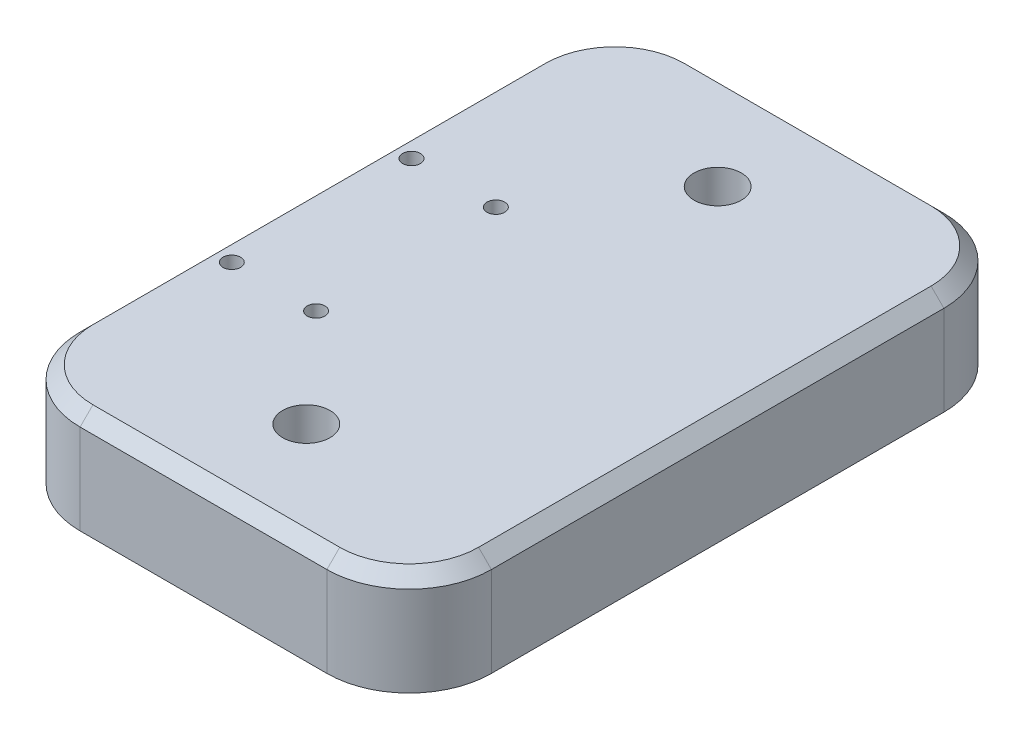
from build123d import *

# Parameters (mm, degrees)
SKETCH1_W           = 76.2
SKETCH1_H           = 12.7
BOSS_EXTRUDE1_DEPTH = 50.8
SKETCH3_R           = 1.0922
SKETCH3_R_2         = 2.921
CUT_EXTRUDE2_DEPTH  = 93.457395594
FILLET1_R           = 10.16
CHAMFER1_SIZE       = 1.5875


with BuildPart() as part:
    # Sketch1 → Boss-Extrude1 (new body)
    with BuildSketch(Plane(origin=(0, 0, 0), x_dir=(0, 0, -1), z_dir=(1, 0, 0))):
        with Locations((38.1, 6.35)):
            Rectangle(SKETCH1_W, SKETCH1_H)
    extrude(amount=BOSS_EXTRUDE1_DEPTH)

    # Sketch3 → Cut-Extrude2 (cut, through all)
    with BuildSketch(Plane.XZ):
        with Locations(Location((13.9065, -25.4, 0), (0, 0, 270))):
            Circle(SKETCH3_R)
        with Locations(Location((25.4, -63.5, 0), (0, 0, 270))):
            Circle(SKETCH3_R_2)
        with Locations(Location((25.4, -12.7, 0), (0, 0, 270))):
            Circle(SKETCH3_R_2)
        with Locations(Location((3.4925, -25.4, 0), (0, 0, 270))):
            Circle(SKETCH3_R)
        with Locations(Location((3.4925, -47.5996, 0), (0, 0, 270))):
            Circle(SKETCH3_R)
        with Locations(Location((13.9065, -47.5996, 0), (0, 0, 270))):
            Circle(SKETCH3_R)
    extrude(amount=-CUT_EXTRUDE2_DEPTH, mode=Mode.SUBTRACT)

    # Fillet1
    fillet1_edges = [part.edges().sort_by_distance(p)[0] for p in [
        (50.8, 6.35, -76.2),
        (50.8, 6.35, 0),
        (0, 6.35, -76.2),
        (0, 6.35, 0),
    ]]
    fillet(fillet1_edges, radius=FILLET1_R)

    # Chamfer1
    chamfer1_edges = [part.edges().sort_by_distance(p)[0] for p in [
        (25.4, 12.7, 0),
        (0, 12.7, -38.1),
        (50.8, 12.7, -38.1),
        (25.4, 12.7, -76.2),
        (47.824204897, 12.7, -73.224204897),
        (2.975795103, 12.7, -73.224204897),
        (47.824204897, 12.7, -2.975795103),
        (2.975795103, 12.7, -2.975795103),
    ]]
    chamfer(chamfer1_edges, length=CHAMFER1_SIZE)


solid = part.part
